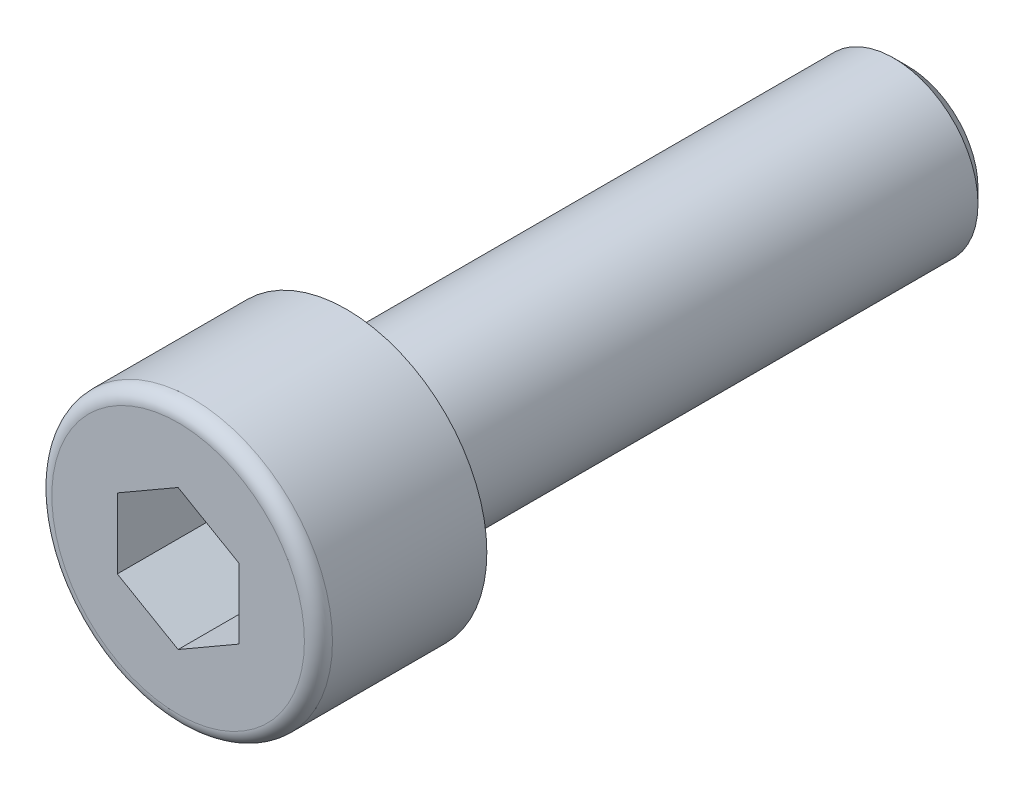
from build123d import *

# Parameters (mm, degrees)
ESQUISSE1_R             = 3
BASE_EXTRUSION_DEPTH    = 26
CHANFREIN1_SIZE         = 0.5
ESQUISSE2_R             = 5
BOSS_EXTRU_1_DEPTH      = 6
ENL_V_MAT_EXTRU_1_DEPTH = 3.5
CONG_2_R                = 0.5


with BuildPart() as part:
    # Esquisse1 → Base-Extrusion (new body)
    with BuildSketch(Plane.XY):
        Circle(ESQUISSE1_R)
    extrude(amount=BASE_EXTRUSION_DEPTH)

    # Chanfrein1
    chanfrein1_edges = [part.edges().sort_by_distance(p)[0] for p in [
        (-3, 0, 0),
    ]]
    chamfer(chanfrein1_edges, length=CHANFREIN1_SIZE)

    # Esquisse2 → Boss.-Extru.1 (add)
    with BuildSketch(Plane.XY.offset(20)):
        Circle(ESQUISSE2_R)
    extrude(amount=BOSS_EXTRU_1_DEPTH)

    # Esquisse3 → Enlèv. mat.-Extru.1 (cut)
    with BuildSketch(Plane.XY.offset(26)):
        Polygon((0, 2.5), (-2.165063509, 1.25), (-2.165063509, -1.25), (0, -2.5), (2.165063509, -1.25), (2.165063509, 1.25), align=None)
    extrude(amount=-ENL_V_MAT_EXTRU_1_DEPTH, mode=Mode.SUBTRACT)

    # Congé2
    cong_2_edges = [part.edges().sort_by_distance(p)[0] for p in [
        (-5, 0, 26),
    ]]
    fillet(cong_2_edges, radius=CONG_2_R)


solid = part.part
